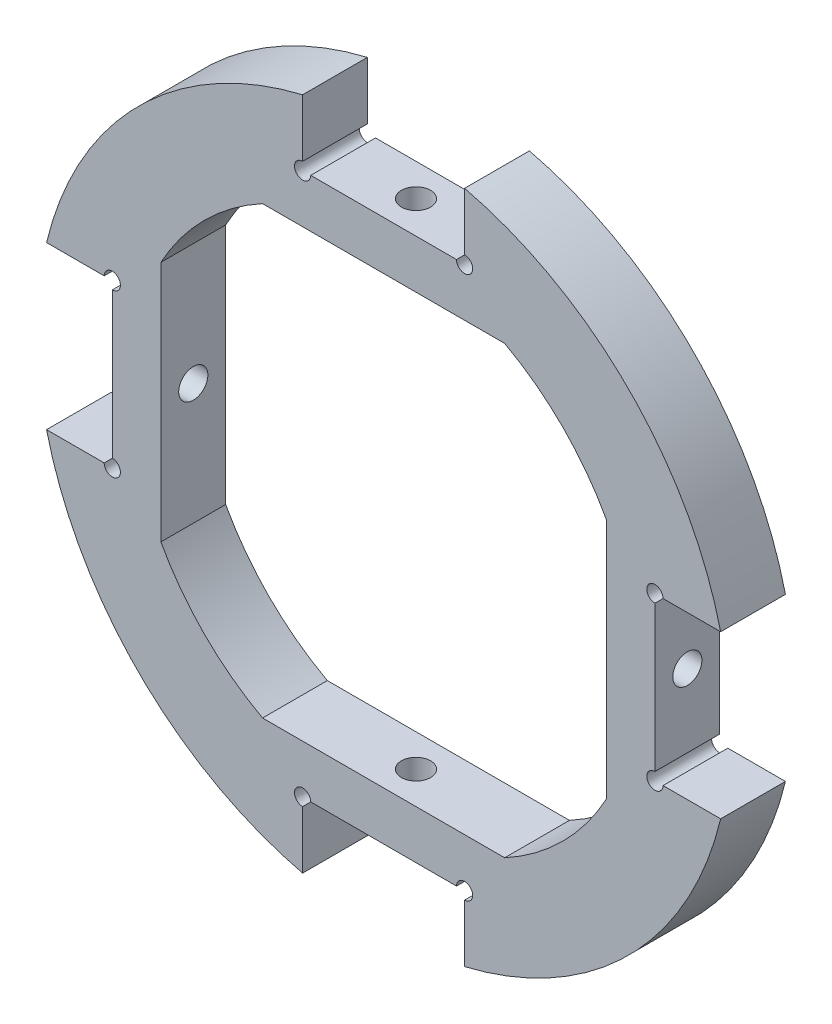
from build123d import *

# Parameters (mm, degrees)
EXTRUDE_1_DEPTH          = 4
SKETCH_2_R               = 0.9
CUT_EXTRUDE_1_DEPTH      = 43
PATTERN_CIRCULAR_1_COUNT = 4


with BuildPart() as part:
    # 草图1 → 凸台-拉伸1 (new body)
    with BuildSketch(Plane.XY):
        with BuildLine():
            Line((-4.5, 16.75), (4.5, 16.75))
            ThreePointArc((4.5, 16.75), (5.353553391, 16.396446609), (5, 17.25))
            Line((5, 17.25), (5, 20.807690886))
            ThreePointArc((5, 20.807690886), (15.132085117, 15.132085117), (20.807690886, 5))
            Line((20.807690886, 5), (17.25, 5))
            ThreePointArc((17.25, 5), (16.396446609, 5.353553391), (16.75, 4.5))
            Line((16.75, 4.5), (16.75, -4.5))
            ThreePointArc((16.75, -4.5), (16.396446609, -5.353553391), (17.25, -5))
            Line((17.25, -5), (20.807690886, -5))
            ThreePointArc((20.807690886, -5), (15.132085117, -15.132085117), (5, -20.807690886))
            Line((5, -20.807690886), (5, -17.25))
            ThreePointArc((5, -17.25), (5.353553391, -16.396446609), (4.5, -16.75))
            Line((4.5, -16.75), (-4.5, -16.75))
            ThreePointArc((-4.5, -16.75), (-5.353553391, -16.396446609), (-5, -17.25))
            Line((-5, -17.25), (-5, -20.807690886))
            ThreePointArc((-5, -20.807690886), (-15.132085117, -15.132085117), (-20.807690886, -5))
            Line((-20.807690886, -5), (-17.25, -5))
            ThreePointArc((-17.25, -5), (-16.396446609, -5.353553391), (-16.75, -4.5))
            Line((-16.75, -4.5), (-16.75, 4.5))
            ThreePointArc((-16.75, 4.5), (-16.396446609, 5.353553391), (-17.25, 5))
            Line((-17.25, 5), (-20.807690886, 5))
            ThreePointArc((-20.807690886, 5), (-15.132085117, 15.132085117), (-5, 20.807690886))
            Line((-5, 20.807690886), (-5, 17.25))
            ThreePointArc((-5, 17.25), (-5.353553391, 16.396446609), (-4.5, 16.75))
        make_face()
        with BuildLine():
            Line((-7.473954776, -13.75), (7.473954776, -13.75))
            ThreePointArc((7.473954776, -13.75), (11.066221126, -11.066221126), (13.75, -7.473954776))
            Line((13.75, -7.473954776), (13.75, 7.473954776))
            ThreePointArc((13.75, 7.473954776), (11.066221126, 11.066221126), (7.473954776, 13.75))
            Line((7.473954776, 13.75), (-7.473954776, 13.75))
            ThreePointArc((-7.473954776, 13.75), (-11.066221126, 11.066221126), (-13.75, 7.473954776))
            Line((-13.75, 7.473954776), (-13.75, -7.473954776))
            ThreePointArc((-13.75, -7.473954776), (-11.066221126, -11.066221126), (-7.473954776, -13.75))
        make_face(mode=Mode.SUBTRACT)
    extrude(amount=EXTRUDE_1_DEPTH)

    # 草图2 → 切除-拉伸1 (cut)
    with BuildSketch(Plane(origin=(0, 16.75, 0), x_dir=(1, 0, 0), z_dir=(0, 1, 0))):
        with Locations(Location((0, -2, 0), (0, 0, 180))):
            Circle(SKETCH_2_R)
    cut_extrude_1 = extrude(amount=-CUT_EXTRUDE_1_DEPTH, mode=Mode.SUBTRACT)

    # 阵列(圆周)1: 切除-拉伸1 ×4 about axis
    pattern_circular_1_axis = Axis((0, 0, 4), (0, 0, -1))
    for i in range(1, PATTERN_CIRCULAR_1_COUNT):
        add(cut_extrude_1.rotate(pattern_circular_1_axis, i * 360 / PATTERN_CIRCULAR_1_COUNT), mode=Mode.SUBTRACT)


solid = part.part
